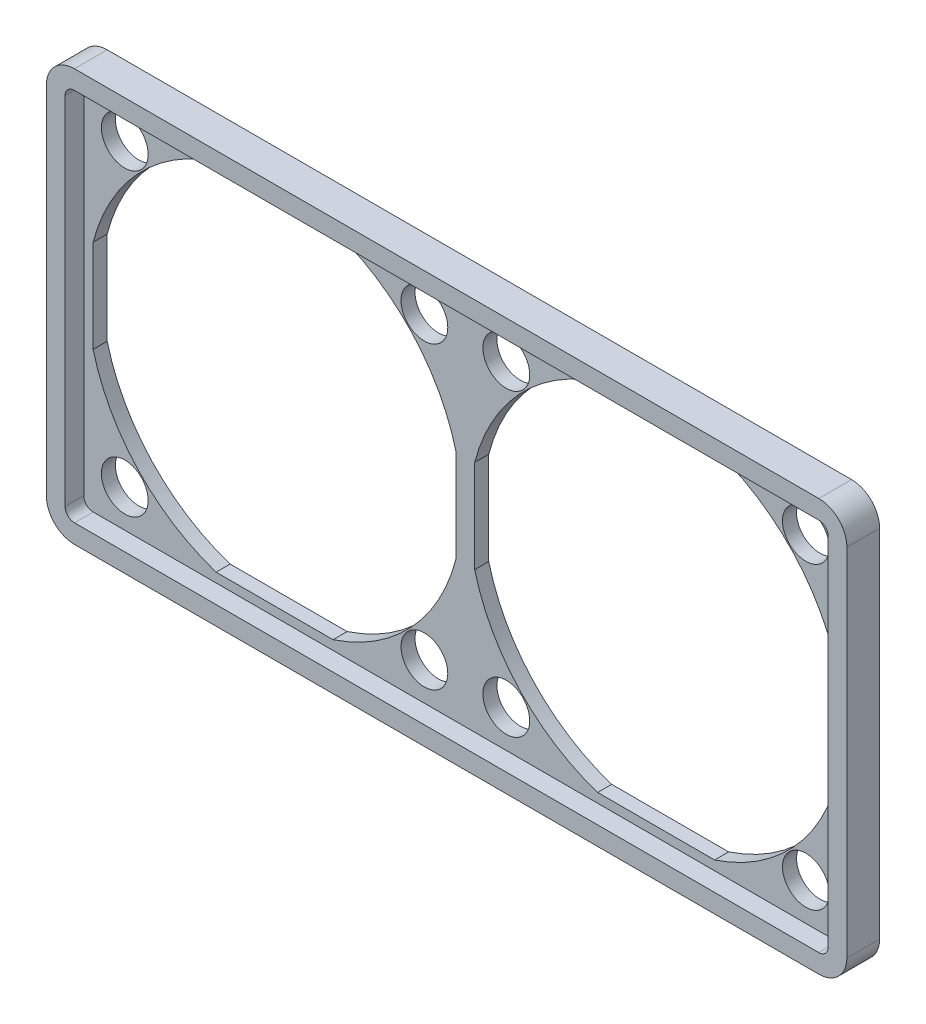
from build123d import *

# Parameters (mm, degrees)
SKETCH1_R           = 2.5
BOSS_EXTRUDE1_DEPTH = 1.5
BOSS_EXTRUDE2_DEPTH = 3.5


with BuildPart() as part:
    # Sketch1 → Boss-Extrude1 (new body)
    with BuildSketch(Plane.XY):
        with BuildLine():
            Line((39.75, 20), (-39.75, 20))
            ThreePointArc((-39.75, 20), (-40.457106781, 19.707106781), (-40.75, 19))
            Line((-40.75, 19), (-40.75, -19))
            ThreePointArc((-40.75, -19), (-40.457106781, -19.707106781), (-39.75, -20))
            Line((-39.75, -20), (39.75, -20))
            ThreePointArc((39.75, -20), (40.457106781, -19.707106781), (40.75, -19))
            Line((40.75, -19), (40.75, 19))
            ThreePointArc((40.75, 19), (40.457106781, 19.707106781), (39.75, 20))
        make_face()
        with Locations((-36.375, 16)):
            Circle(SKETCH1_R, mode=Mode.SUBTRACT)
        with Locations((-4.375, 16)):
            Circle(SKETCH1_R, mode=Mode.SUBTRACT)
        with Locations((-4.375, -16)):
            Circle(SKETCH1_R, mode=Mode.SUBTRACT)
        with Locations((-36.375, -16)):
            Circle(SKETCH1_R, mode=Mode.SUBTRACT)
        with Locations(Location((36.375, -16, 0), (0, 0, 180))):
            Circle(SKETCH1_R, mode=Mode.SUBTRACT)
        with Locations(Location((4.375, -16, 0), (0, 0, 180))):
            Circle(SKETCH1_R, mode=Mode.SUBTRACT)
        with Locations(Location((4.375, 16, 0), (0, 0, 180))):
            Circle(SKETCH1_R, mode=Mode.SUBTRACT)
        with Locations(Location((36.375, 16, 0), (0, 0, 180))):
            Circle(SKETCH1_R, mode=Mode.SUBTRACT)
        with BuildLine():
            Line((26.619997998, 19), (14.130002002, 19))
            ThreePointArc((14.130002002, 19), (5.767776688, 13.661223485), (1, 4.960783708))
            Line((1, 4.960783708), (1, -4.960783708))
            ThreePointArc((1, -4.960783708), (5.767776688, -13.661223485), (14.130002002, -19))
            Line((14.130002002, -19), (26.619997998, -19))
            ThreePointArc((26.619997998, -19), (34.982223312, -13.661223485), (39.75, -4.960783708))
            Line((39.75, -4.960783708), (39.75, 4.960783708))
            ThreePointArc((39.75, 4.960783708), (34.982223312, 13.661223485), (26.619997998, 19))
        make_face(mode=Mode.SUBTRACT)
        with BuildLine():
            Line((-39.75, 4.960783708), (-39.75, -4.960783708))
            ThreePointArc((-39.75, -4.960783708), (-34.982223312, -13.661223485), (-26.619997998, -19))
            Line((-26.619997998, -19), (-14.130002002, -19))
            ThreePointArc((-14.130002002, -19), (-5.767776688, -13.661223485), (-1, -4.960783708))
            Line((-1, -4.960783708), (-1, 4.960783708))
            ThreePointArc((-1, 4.960783708), (-5.767776688, 13.661223485), (-14.130002002, 19))
            Line((-14.130002002, 19), (-26.619997998, 19))
            ThreePointArc((-26.619997998, 19), (-34.982223312, 13.661223485), (-39.75, 4.960783708))
        make_face(mode=Mode.SUBTRACT)
    extrude(amount=BOSS_EXTRUDE1_DEPTH)

    # Sketch2 → Boss-Extrude2 (add)
    with BuildSketch(Plane(origin=(0, 0, 0), x_dir=(-1, 0, 0), z_dir=(0, 0, -1))):
        with BuildLine():
            Line((39.75, 22), (-39.75, 22))
            ThreePointArc((-39.75, 22), (-41.871320344, 21.121320344), (-42.75, 19))
            Line((-42.75, 19), (-42.75, -19))
            ThreePointArc((-42.75, -19), (-41.871320344, -21.121320344), (-39.75, -22))
            Line((-39.75, -22), (39.75, -22))
            ThreePointArc((39.75, -22), (41.871320344, -21.121320344), (42.75, -19))
            Line((42.75, -19), (42.75, 19))
            ThreePointArc((42.75, 19), (41.871320344, 21.121320344), (39.75, 22))
        make_face()
        with BuildLine():
            Line((40.75, -19), (40.75, 19))
            ThreePointArc((40.75, 19), (40.457106781, 19.707106781), (39.75, 20))
            Line((39.75, 20), (-39.75, 20))
            ThreePointArc((-39.75, 20), (-40.457106781, 19.707106781), (-40.75, 19))
            Line((-40.75, 19), (-40.75, -19))
            ThreePointArc((-40.75, -19), (-40.457106781, -19.707106781), (-39.75, -20))
            Line((-39.75, -20), (39.75, -20))
            ThreePointArc((39.75, -20), (40.457106781, -19.707106781), (40.75, -19))
        make_face(mode=Mode.SUBTRACT)
    extrude(amount=-BOSS_EXTRUDE2_DEPTH)


solid = part.part
